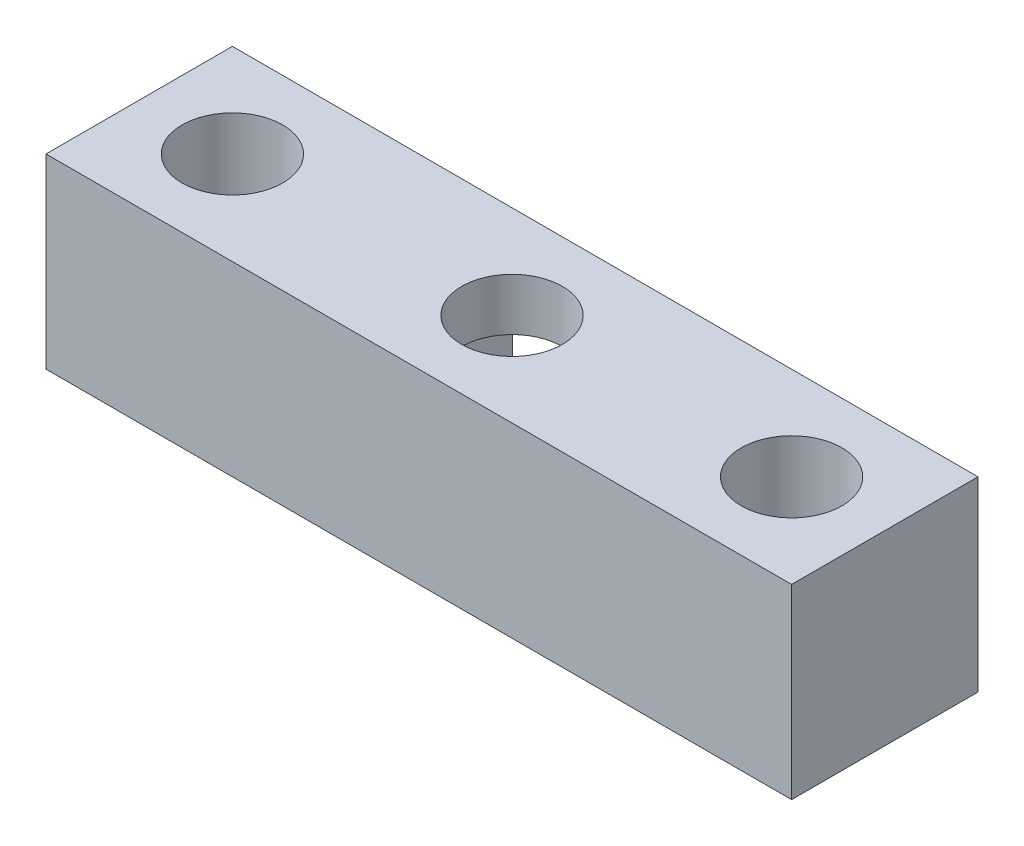
from build123d import *

# Parameters (mm, degrees)
SKETCH1_W           = 50.8
SKETCH1_H           = 12.7
BOSS_EXTRUDE1_DEPTH = 12.7
SKETCH2_R           = 3.429
CUT_EXTRUDE1_DEPTH  = 32.108519733
CUT_EXTRUDE2_DEPTH  = 2.794


with BuildPart() as part:
    # Sketch1 → Boss-Extrude1 (new body)
    with BuildSketch(Plane(origin=(0, 0, 0), x_dir=(1, 0, 0), z_dir=(0, 1, 0))):
        with Locations((0, 6.35)):
            Rectangle(SKETCH1_W, SKETCH1_H)
    extrude(amount=BOSS_EXTRUDE1_DEPTH)

    # Sketch2 → Cut-Extrude1 (cut, through all)
    with BuildSketch(Plane(origin=(0, 12.7, 0), x_dir=(1, 0, 0), z_dir=(0, 1, 0))):
        with Locations(Location((-19.05, 6.35, 0), (0, 0, 270))):
            Circle(SKETCH2_R)
        with Locations(Location((19.05, 6.35, 0), (0, 0, 270))):
            Circle(SKETCH2_R)
        with Locations(Location((0, 6.35, 0), (0, 0, 270))):
            Circle(SKETCH2_R)
    extrude(amount=-CUT_EXTRUDE1_DEPTH, mode=Mode.SUBTRACT)

    # Sketch3 → Cut-Extrude2 (cut, symmetric)
    with BuildSketch(Plane(origin=(0, 6.35, 0), x_dir=(1, 0, 0), z_dir=(0, 1, 0))):
        Polygon((-6.30581964, 6.35), (-6.30581964, 19.396139052), (6.30581964, 19.396139052), (6.30581964, 6.35), (3.15290982, 0.889), (-3.15290982, 0.889), align=None)
    extrude(amount=CUT_EXTRUDE2_DEPTH, both=True, mode=Mode.SUBTRACT)


solid = part.part
